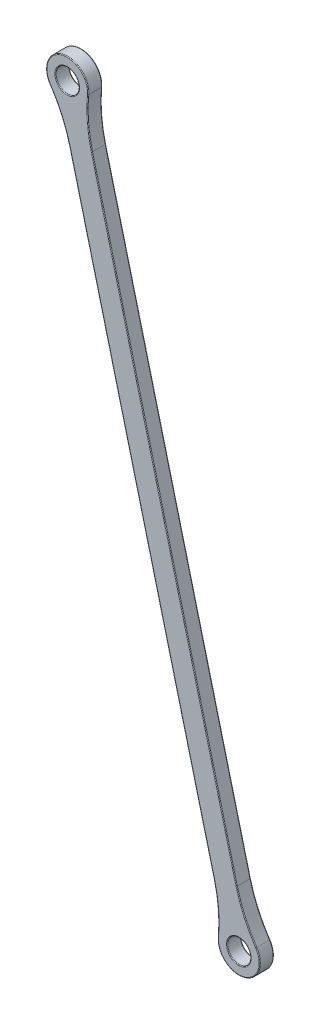
from build123d import *

# Parameters (mm, degrees)
BOSS_EXTRUDE1_DEPTH = 3
FILLET1_R           = 30
FILLET2_R           = 0.15


with BuildPart() as part:
    # Sketch1 → Boss-Extrude1 (new body)
    with BuildSketch(Plane.XY):
        with BuildLine():
            ThreePointArc((16.921395106, 82.121969245), (13.878030755, 83.921395106), (12.078604894, 80.878030755))
            Line((12.078604894, 80.878030755), (-24.741974394, 224.224621021))
            ThreePointArc((-24.741974394, 224.224621021), (-21.698610044, 222.42519516), (-19.899184183, 225.468559511))
            Line((-19.899184183, 225.468559511), (16.921395106, 82.121969245))
        make_face()
        with BuildLine():
            ThreePointArc((-24.741974394, 224.224621021), (-22.942548533, 227.267985372), (-19.899184183, 225.468559511))
            Line((-19.899184183, 225.468559511), (-18.968305855, 221.844547157))
            ThreePointArc((-18.968305855, 221.844547157), (-23.440123929, 229.205101456), (-23.811096067, 220.600608668))
            Line((-23.811096067, 220.600608668), (-24.741974394, 224.224621021))
        make_face()
        with BuildLine():
            ThreePointArc((11.147726567, 84.502043109), (15.619544641, 77.141488809), (15.990516778, 85.745981598))
            Line((15.990516778, 85.745981598), (16.921395106, 82.121969245))
            ThreePointArc((16.921395106, 82.121969245), (15.121969245, 79.078604894), (12.078604894, 80.878030755))
            Line((12.078604894, 80.878030755), (11.147726567, 84.502043109))
        make_face()
    extrude(amount=BOSS_EXTRUDE1_DEPTH)

    # Fillet1
    fillet1_edges = [part.edges().sort_by_distance(p)[0] for p in [
        (15.990516778, 85.745981598, 1.5),
        (11.147726567, 84.502043109, 1.5),
        (-23.811096067, 220.600608668, 1.5),
        (-18.968305855, 221.844547157, 1.5),
    ]]
    fillet(fillet1_edges, radius=FILLET1_R)

    # Fillet2
    fillet2_edges = [part.edges().sort_by_distance(p)[0] for p in [
        (-1.488894538, 153.795264378, 0),
        (-1.488894538, 153.795264378, 3),
        (15.619544641, 77.141488809, 0),
        (15.619544641, 77.141488809, 3),
        (12.078604894, 80.878030755, 3),
        (-6.33168475, 152.551325888, 0),
        (-6.33168475, 152.551325888, 3),
        (-23.440123929, 229.205101456, 0),
        (-23.440123929, 229.205101456, 3),
        (15.73637098, 88.495854984, 0),
        (15.73637098, 88.495854984, 3),
        (10.045163223, 87.033988566, 0),
        (10.045163223, 87.033988566, 3),
        (-23.556950269, 217.850735282, 0),
        (-19.899184183, 225.468559511, 3),
        (-23.556950269, 217.850735282, 3),
        (-17.865742511, 219.3126017, 0),
        (-17.865742511, 219.3126017, 3),
        (-19.899184183, 225.468559511, 0),
        (12.078604894, 80.878030755, 0),
    ]]
    fillet(fillet2_edges, radius=FILLET2_R)


solid = part.part
